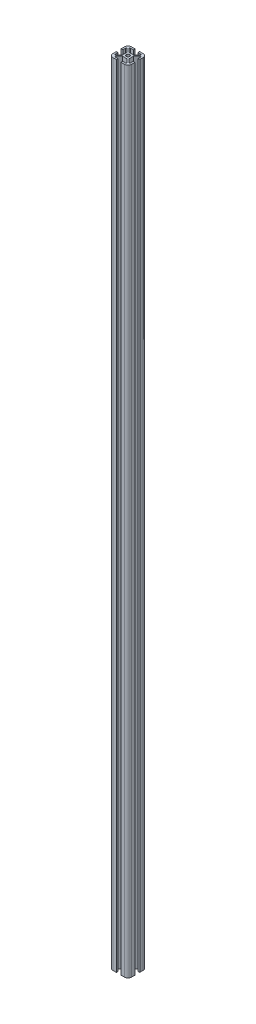
from build123d import *

# Parameters (mm, degrees)
SKETCH1_R           = 25
BOSS_EXTRUDE1_DEPTH = 12000


with BuildPart() as part:
    # Sketch1 → Boss-Extrude1 (new body)
    with BuildSketch(Plane(origin=(0, 0, 0), x_dir=(1, 0, 0), z_dir=(0, 1, 0))):
        with BuildLine():
            Line((-35, 50), (35, 50))
            Line((35, 50), (84.497474683, 99.497474683))
            ThreePointArc((84.497474683, 99.497474683), (86.61573408, 110.146683804), (77.587770512, 116.178976204))
            Line((77.587770512, 116.178976204), (35, 116.178976204))
            Line((35, 116.178976204), (35, 141.178976204))
            Line((35, 141.178976204), (88.56067906, 141.178976204))
            ThreePointArc((88.56067906, 141.178976204), (125.778036691, 125.656179819), (141.179257486, 88.388347648))
            Line((141.179257486, 88.388347648), (141.179257486, 37.5))
            Line((141.179257486, 37.5), (116.179257486, 37.5))
            Line((116.179257486, 37.5), (116.179257486, 77.587654002))
            ThreePointArc((116.179257486, 77.587654002), (110.14686337, 86.615769798), (99.497474683, 84.497474683))
            Line((99.497474683, 84.497474683), (50, 35))
            Line((50, 35), (50, -35))
            Line((50, -35), (99.497474683, -84.497474683))
            ThreePointArc((99.497474683, -84.497474683), (110.14686337, -86.615769798), (116.179257486, -77.587654002))
            Line((116.179257486, -77.587654002), (116.179257486, -37.5))
            Line((116.179257486, -37.5), (141.179257486, -37.5))
            Line((141.179257486, -37.5), (141.179257486, -88.388347648))
            ThreePointArc((141.179257486, -88.388347648), (125.778036691, -125.656179819), (88.56067906, -141.178976204))
            Line((88.56067906, -141.178976204), (35, -141.178976204))
            Line((35, -141.178976204), (35, -116.178976204))
            Line((35, -116.178976204), (77.587770512, -116.178976204))
            ThreePointArc((77.587770512, -116.178976204), (86.61573408, -110.146683804), (84.497474683, -99.497474683))
            Line((84.497474683, -99.497474683), (35, -50))
            Line((35, -50), (-35, -50))
            Line((-35, -50), (-84.497474683, -99.497474683))
            ThreePointArc((-84.497474683, -99.497474683), (-86.61573408, -110.146683804), (-77.587770512, -116.178976204))
            Line((-77.587770512, -116.178976204), (-35, -116.178976204))
            Line((-35, -116.178976204), (-35, -141.178976204))
            Line((-35, -141.178976204), (-88.56067906, -141.178976204))
            ThreePointArc((-88.56067906, -141.178976204), (-125.778036691, -125.656179819), (-141.179257486, -88.388347648))
            Line((-141.179257486, -88.388347648), (-141.179257486, -37.5))
            Line((-141.179257486, -37.5), (-116.179257486, -37.5))
            Line((-116.179257486, -37.5), (-116.179257486, -77.587654002))
            ThreePointArc((-116.179257486, -77.587654002), (-110.14686337, -86.615769798), (-99.497474683, -84.497474683))
            Line((-99.497474683, -84.497474683), (-50, -35))
            Line((-50, -35), (-50, 35))
            Line((-50, 35), (-99.497474683, 84.497474683))
            ThreePointArc((-99.497474683, 84.497474683), (-110.14686337, 86.615769798), (-116.179257486, 77.587654002))
            Line((-116.179257486, 77.587654002), (-116.179257486, 37.5))
            Line((-116.179257486, 37.5), (-141.179257486, 37.5))
            Line((-141.179257486, 37.5), (-141.179257486, 88.388347648))
            ThreePointArc((-141.179257486, 88.388347648), (-125.778036691, 125.656179819), (-88.56067906, 141.178976204))
            Line((-88.56067906, 141.178976204), (-35, 141.178976204))
            Line((-35, 141.178976204), (-35, 116.178976204))
            Line((-35, 116.178976204), (-77.587770512, 116.178976204))
            ThreePointArc((-77.587770512, 116.178976204), (-86.61573408, 110.146683804), (-84.497474683, 99.497474683))
            Line((-84.497474683, 99.497474683), (-35, 50))
        make_face()
        with Locations(Location((0, 0, 0), (0, 0, 90))):
            Circle(SKETCH1_R, mode=Mode.SUBTRACT)
    extrude(amount=BOSS_EXTRUDE1_DEPTH)


solid = part.part
